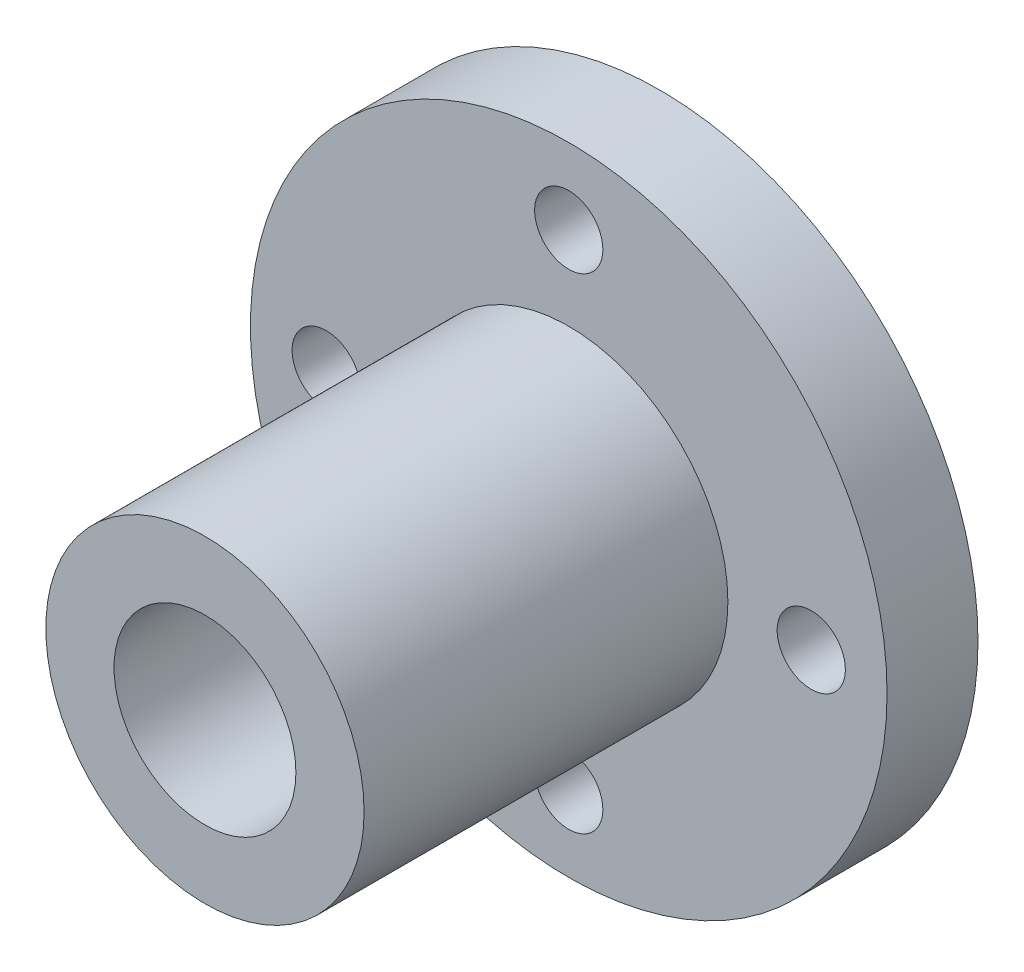
from build123d import *

# Parameters (mm, degrees)
SKETCH1_R           = 21
BOSS_EXTRUDE1_DEPTH = 6
SKETCH2_R           = 10.5
BOSS_EXTRUDE2_DEPTH = 24
SKETCH3_R           = 6
CUT_EXTRUDE1_DEPTH  = 43.213741838
SKETCH4_R           = 2.25
CUT_EXTRUDE2_DEPTH  = 39.183766184


with BuildPart() as part:
    # Sketch1 → Boss-Extrude1 (new body)
    with BuildSketch(Plane.XY):
        Circle(SKETCH1_R)
    extrude(amount=BOSS_EXTRUDE1_DEPTH)

    # Sketch2 → Boss-Extrude2 (add)
    with BuildSketch(Plane.XY.offset(6)):
        Circle(SKETCH2_R)
    extrude(amount=BOSS_EXTRUDE2_DEPTH)

    # Sketch3 → Cut-Extrude1 (cut, through all)
    with BuildSketch(Plane.XY.offset(30)):
        Circle(SKETCH3_R)
    extrude(amount=-CUT_EXTRUDE1_DEPTH, mode=Mode.SUBTRACT)

    # Sketch4 → Cut-Extrude2 (cut, through all)
    with BuildSketch(Plane.XY.offset(6)):
        with Locations((-16, 0)):
            Circle(SKETCH4_R)
        with Locations((0, 16)):
            Circle(SKETCH4_R)
        with Locations((16, 0)):
            Circle(SKETCH4_R)
        with Locations((0, -16)):
            Circle(SKETCH4_R)
    extrude(amount=-CUT_EXTRUDE2_DEPTH, mode=Mode.SUBTRACT)


solid = part.part
